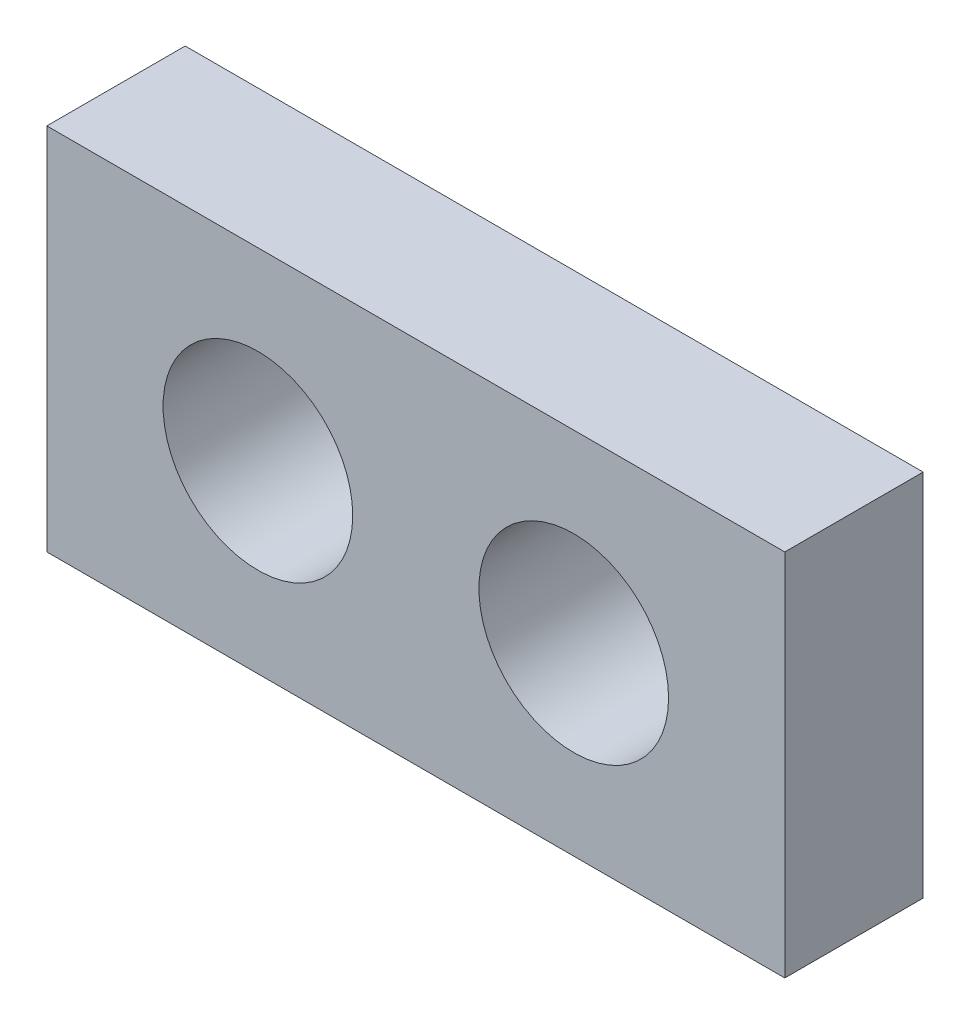
from build123d import *

# Parameters (mm, degrees)
SKETCH1_W                    = 25.4
SKETCH1_H                    = 12.7
EXTRUDE1_DEPTH               = 4.7625
F_0_257_DIAMETER_HOLE1_D     = 6.5278
F_0_257_DIAMETER_HOLE1_DEPTH = 12.7
F_0_257_DIAMETER_HOLE1_TIP   = 1.961148974


with BuildPart() as part:
    # Sketch1 → Extrude1 (new body)
    with BuildSketch(Plane.XY):
        Rectangle(SKETCH1_W, SKETCH1_H)
    extrude(amount=EXTRUDE1_DEPTH)

    # F (0.257) Diameter Hole1
    with Locations(Plane(origin=(-5.4356, 0, 4.7625), x_dir=(1, 0, 0), z_dir=(0, 0, 1))):
        with Locations((0, 0), (10.8712, 0)):
            Hole(F_0_257_DIAMETER_HOLE1_D / 2, depth=F_0_257_DIAMETER_HOLE1_DEPTH)
            with Locations((0, 0, -(F_0_257_DIAMETER_HOLE1_DEPTH + F_0_257_DIAMETER_HOLE1_TIP / 2))):  # 118° drill point
                Cone(0, F_0_257_DIAMETER_HOLE1_D / 2, F_0_257_DIAMETER_HOLE1_TIP, mode=Mode.SUBTRACT)


solid = part.part
